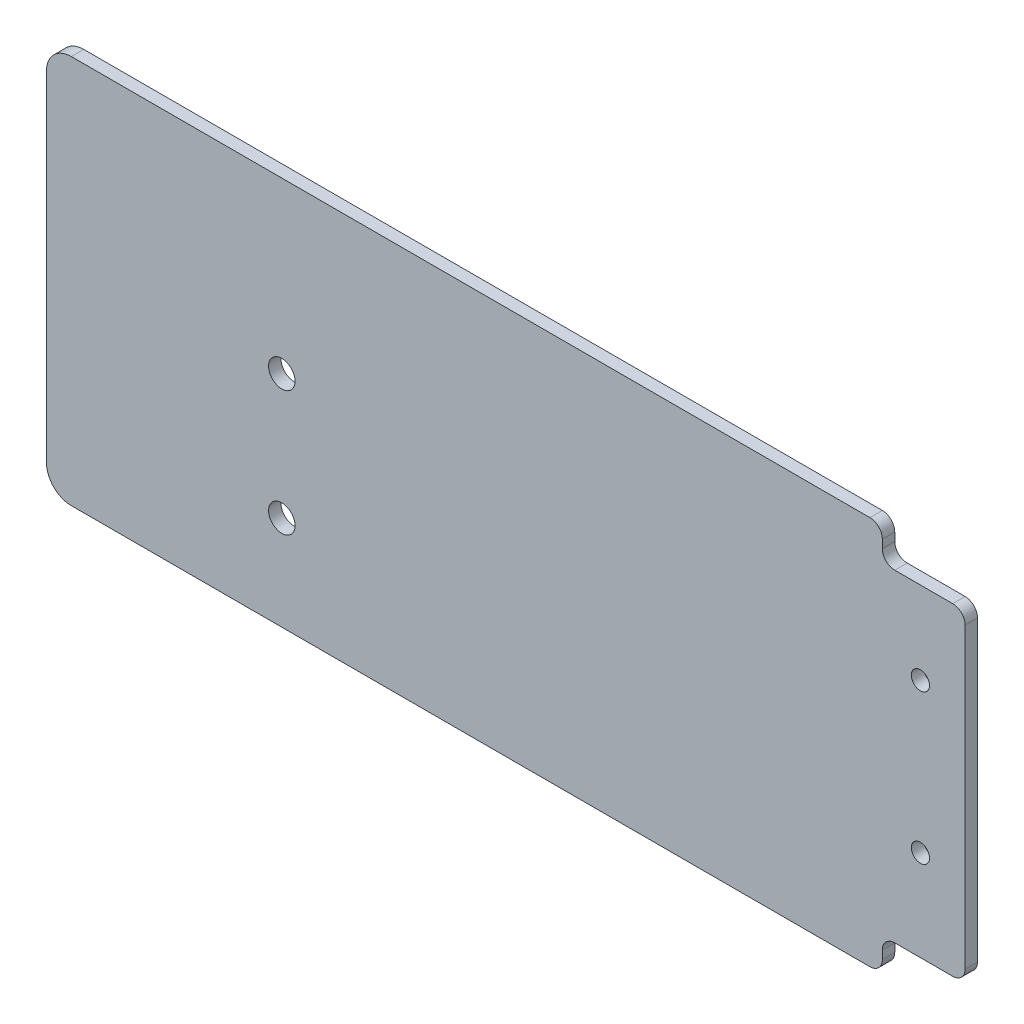
from build123d import *

# Parameters (mm, degrees)
BOSS_EXTRUDE1_DEPTH  = 1.5
CUT_EXTRUDE1_DEPTH   = 114.470260421
FILLET1_R            = 1.5
M3_CLEARANCE_HOLE1_D = 3.2
M2_CLEARANCE_HOLE2_D = 2.2


with BuildPart() as part:
    # Sketch1 → Boss-Extrude1 (new body)
    with BuildSketch(Plane.XY):
        with BuildLine():
            Line((3, -23.5), (109, -23.5))
            ThreePointArc((109, -23.5), (110.414213562, -22.914213562), (111, -21.5))
            Line((111, -21.5), (111, 21.5))
            ThreePointArc((111, 21.5), (110.414213562, 22.914213562), (109, 23.5))
            Line((109, 23.5), (3, 23.5))
            ThreePointArc((3, 23.5), (0.878679656, 22.621320344), (0, 20.5))
            Line((0, 20.5), (0, -20.5))
            ThreePointArc((0, -20.5), (0.878679656, -22.621320344), (3, -23.5))
        make_face()
    extrude(amount=BOSS_EXTRUDE1_DEPTH)

    # Sketch2 → Cut-Extrude1 (cut, through all)
    with BuildSketch(Plane(origin=(0, 0, 0), x_dir=(-1, 0, 0), z_dir=(0, 0, -1))):
        with BuildLine():
            Line((-101, 19.5), (-101, 23.5))
            Line((-101, 23.5), (-109, 23.5))
            ThreePointArc((-109, 23.5), (-110.414213562, 22.914213562), (-111, 21.5))
            Line((-111, 21.5), (-111, 19.5))
            Line((-111, 19.5), (-101, 19.5))
        make_face()
        with BuildLine():
            Line((-101, -19.5), (-111, -19.5))
            Line((-111, -19.5), (-111, -21.5))
            ThreePointArc((-111, -21.5), (-110.414213562, -22.914213562), (-109, -23.5))
            Line((-109, -23.5), (-101, -23.5))
            Line((-101, -23.5), (-101, -19.5))
        make_face()
    extrude(amount=-CUT_EXTRUDE1_DEPTH, mode=Mode.SUBTRACT)

    # Fillet1
    fillet1_edges = [part.edges().sort_by_distance(p)[0] for p in [
        (101, 19.5, 0.75),
        (111, 19.5, 0.75),
        (101, 23.5, 0.75),
        (101, -23.5, 0.75),
        (111, -19.5, 0.75),
        (101, -19.5, 0.75),
    ]]
    fillet(fillet1_edges, radius=FILLET1_R)

    # M3 Clearance Hole1 (through all)
    with Locations(Plane.XY.offset(1.5)):
        with Locations((28.437, 3.0309), (28.437, -12.0821)):
            Hole(M3_CLEARANCE_HOLE1_D / 2)

    # M2 Clearance Hole2 (through all)
    with Locations(Plane.XY.offset(1.5)):
        with Locations((105.6, 9.525), (105.6, -8.525)):
            Hole(M2_CLEARANCE_HOLE2_D / 2)


solid = part.part
